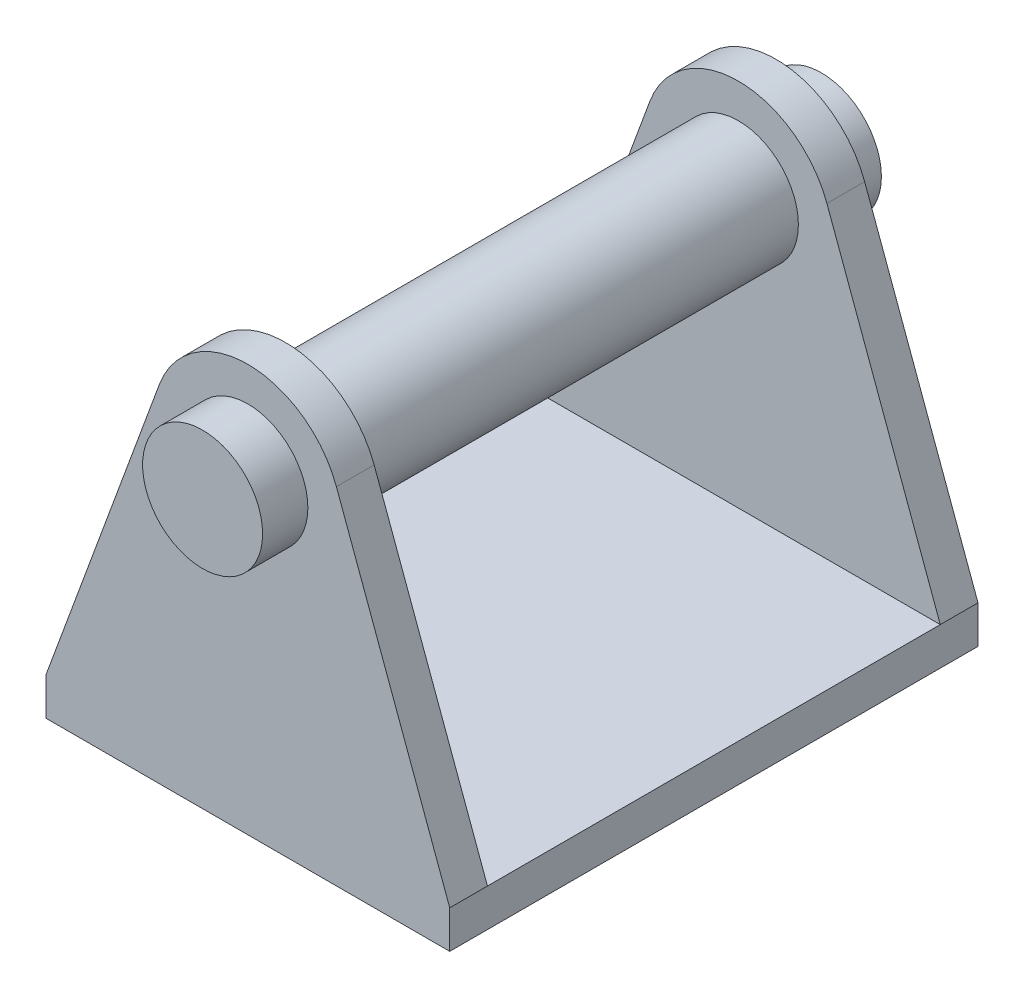
from build123d import *

# Parameters (mm, degrees)
EXTRUDE_1_DEPTH      = 12
EXTRUDE_1_DEPTH_BACK = 152
SKETCH_1_R           = 15.9
SKETCH_1_3_R         = 15.9
EXTRUDE_2_DEPTH      = 10
EXTRUDE_START        = 10
SKETCH_2_R           = 15.9
EXTRUDE_3_DEPTH      = 10
SKETCH_3_W           = 107
SKETCH_3_H           = 120
EXTRUDE_4_DEPTH      = 10


with BuildPart() as part:
    # 草图1 → 凸台-拉伸1 (new, two sides: drawn at the far end of the back side and taken through both)
    with BuildSketch(Plane.XY.offset(-EXTRUDE_1_DEPTH_BACK)):
        with Locations((0, 73)):
            Circle(SKETCH_1_R)
    extrude(amount=EXTRUDE_1_DEPTH + EXTRUDE_1_DEPTH_BACK)

    # 草图1<3> → 凸台-拉伸2 (add)
    with BuildSketch(Plane.XY):
        with BuildLine():
            Line((-53.5, 0), (-53.5, -10))
            Line((-53.5, -10), (53.5, -10))
            Line((53.5, -10), (53.5, 0))
            Line((53.5, 0), (23.462066716, 81.633158484))
            ThreePointArc((23.462066716, 81.633158484), (0, 98), (-23.462066716, 81.633158484))
            Line((-23.462066716, 81.633158484), (-53.5, 0))
        make_face()
        with Locations((0, 73)):
            Circle(SKETCH_1_3_R, mode=Mode.SUBTRACT)
    extrude(amount=-EXTRUDE_2_DEPTH)

    # 草图2 → 凸台-拉伸3 (add)
    with BuildSketch(Plane.XY.offset(-140).offset(EXTRUDE_START)):
        with BuildLine():
            Line((-53.5, 0), (-23.462066716, 81.633158484))
            ThreePointArc((-23.462066716, 81.633158484), (0, 98), (23.462066716, 81.633158484))
            Line((23.462066716, 81.633158484), (53.5, 0))
            Line((53.5, 0), (53.5, -10))
            Line((53.5, -10), (-53.5, -10))
            Line((-53.5, -10), (-53.5, 0))
        make_face()
        with Locations((0, 73)):
            Circle(SKETCH_2_R, mode=Mode.SUBTRACT)
    extrude(amount=-EXTRUDE_3_DEPTH)

    # 草图3 → 凸台-拉伸4 (add)
    with BuildSketch(Plane.XZ.offset(10)):
        with Locations((0, -70)):
            Rectangle(SKETCH_3_W, SKETCH_3_H)
    extrude(amount=-EXTRUDE_4_DEPTH)


solid = part.part
